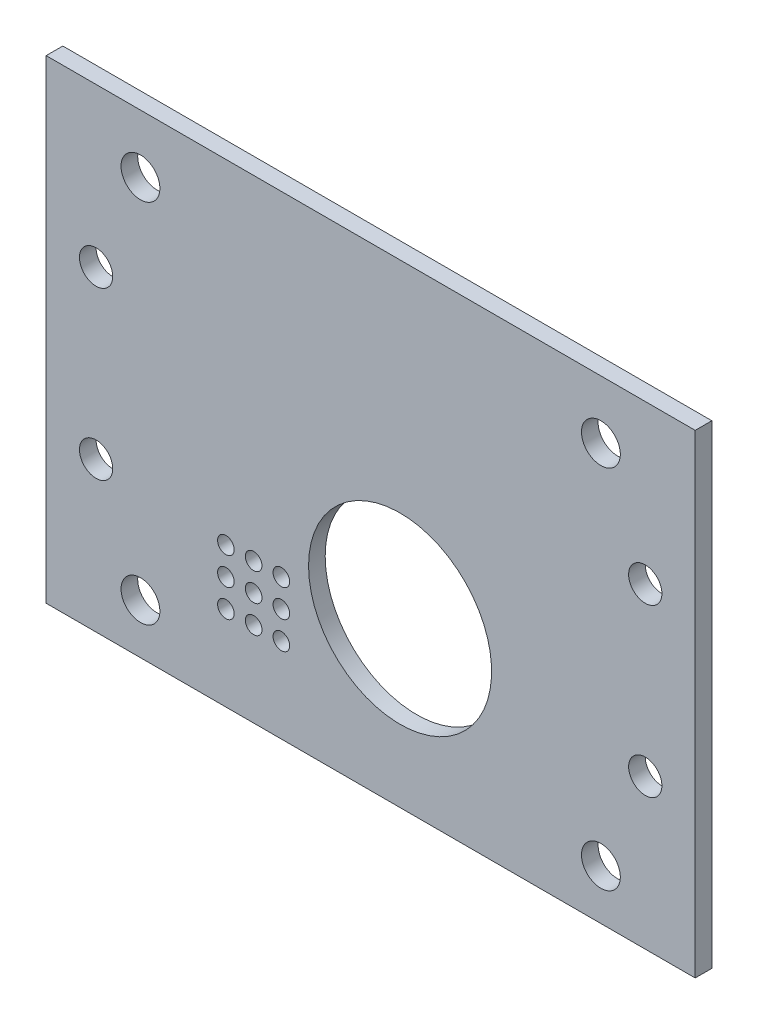
from build123d import *

# Parameters (mm, degrees)
SKETCH_1_W                                     = 117
SKETCH_1_H                                     = 84
BOTTOM_LOWER_BASE_PLATE_3MM_DEPTH              = 3
SKETCH_3_R                                     = 3.5
BOTTOM_LOWER_SCREW_6MM_THROUGH_DEPTH           = 3
SKETCH_5_R                                     = 16.5
BOTTOM_LOWER_BATTERY_CLEARANCE_33MM_DEPTH      = 3
SKETCH_9_R                                     = 1.5
BOTTOM_LOWER_BUZZER_SOUND_HOLES_3MM_DEPTH      = 3
SKETCH_10_R                                    = 3
BOTTOM_LOWER_CENTER_RAIL_SCREW_HEADS_6MM_DEPTH = 6
SKETCH_11_W                                    = 117
SKETCH_11_H                                    = 1.5
BOTTOM_LOWER_REAR_EXTENSION_1P5MM_DEPTH        = 3


with BuildPart() as part:
    # Эскиз1 → bottom_lower_base_plate_3mm (new body)
    with BuildSketch(Plane.XY):
        with Locations((53.5, 40)):
            Rectangle(SKETCH_1_W, SKETCH_1_H)
    extrude(amount=BOTTOM_LOWER_BASE_PLATE_3MM_DEPTH)

    # Эскиз3 → bottom_lower_screw_6mm_through (cut)
    with BuildSketch(Plane.XY):
        with Locations(Location((12, 7, 0), (0, 0, 180))):
            Circle(SKETCH_3_R)
        with Locations(Location((95, 7, 0), (0, 0, 180))):
            Circle(SKETCH_3_R)
        with Locations(Location((12, 73, 0), (0, 0, 180))):
            Circle(SKETCH_3_R)
        with Locations(Location((95, 73, 0), (0, 0, 180))):
            Circle(SKETCH_3_R)
    extrude(amount=BOTTOM_LOWER_SCREW_6MM_THROUGH_DEPTH, mode=Mode.SUBTRACT)

    # Эскиз5 → bottom_lower_battery_clearance_33mm (cut)
    with BuildSketch(Plane(origin=(0, 8, 0), x_dir=(1, 0, 0), z_dir=(0, 0, 1))):
        with Locations(Location((58.8, 19.5, 0), (0, 0, 180))):
            Circle(SKETCH_5_R)
    extrude(amount=BOTTOM_LOWER_BATTERY_CLEARANCE_33MM_DEPTH, mode=Mode.SUBTRACT)

    # Эскиз9 → bottom_lower_buzzer_sound_holes_3mm (cut)
    with BuildSketch(Plane(origin=(0, 4, 0), x_dir=(1, 0, 0), z_dir=(0, 0, 1))):
        with Locations(Location((27.4, 9.3, 0), (0, 0, 180))):
            Circle(SKETCH_9_R)
        with Locations(Location((27.4, 14.3, 0), (0, 0, 180))):
            Circle(SKETCH_9_R)
        with Locations(Location((27.4, 19.3, 0), (0, 0, 180))):
            Circle(SKETCH_9_R)
        with Locations(Location((32.4, 9.3, 0), (0, 0, 180))):
            Circle(SKETCH_9_R)
        with Locations(Location((32.4, 14.3, 0), (0, 0, 180))):
            Circle(SKETCH_9_R)
        with Locations(Location((32.4, 19.3, 0), (0, 0, 180))):
            Circle(SKETCH_9_R)
        with Locations(Location((37.4, 9.3, 0), (0, 0, 180))):
            Circle(SKETCH_9_R)
        with Locations(Location((37.4, 14.3, 0), (0, 0, 180))):
            Circle(SKETCH_9_R)
        with Locations(Location((37.4, 19.3, 0), (0, 0, 180))):
            Circle(SKETCH_9_R)
    extrude(amount=BOTTOM_LOWER_BUZZER_SOUND_HOLES_3MM_DEPTH, mode=Mode.SUBTRACT)

    # Эскиз10 → bottom_lower_center_rail_screw_heads_6mm (cut)
    with BuildSketch(Plane.XY):
        with Locations(Location((4, 25, 0), (0, 0, 180))):
            Circle(SKETCH_10_R)
        with Locations(Location((4, 55, 0), (0, 0, 180))):
            Circle(SKETCH_10_R)
        with Locations(Location((103, 25, 0), (0, 0, 180))):
            Circle(SKETCH_10_R)
        with Locations(Location((103, 55, 0), (0, 0, 180))):
            Circle(SKETCH_10_R)
    extrude(amount=BOTTOM_LOWER_CENTER_RAIL_SCREW_HEADS_6MM_DEPTH, mode=Mode.SUBTRACT)

    # Эскиз11 → bottom_lower_rear_extension_1p5mm (add)
    with BuildSketch(Plane.XY):
        with Locations((53.5, 82.75)):
            Rectangle(SKETCH_11_W, SKETCH_11_H)
    extrude(amount=BOTTOM_LOWER_REAR_EXTENSION_1P5MM_DEPTH)


solid = part.part
